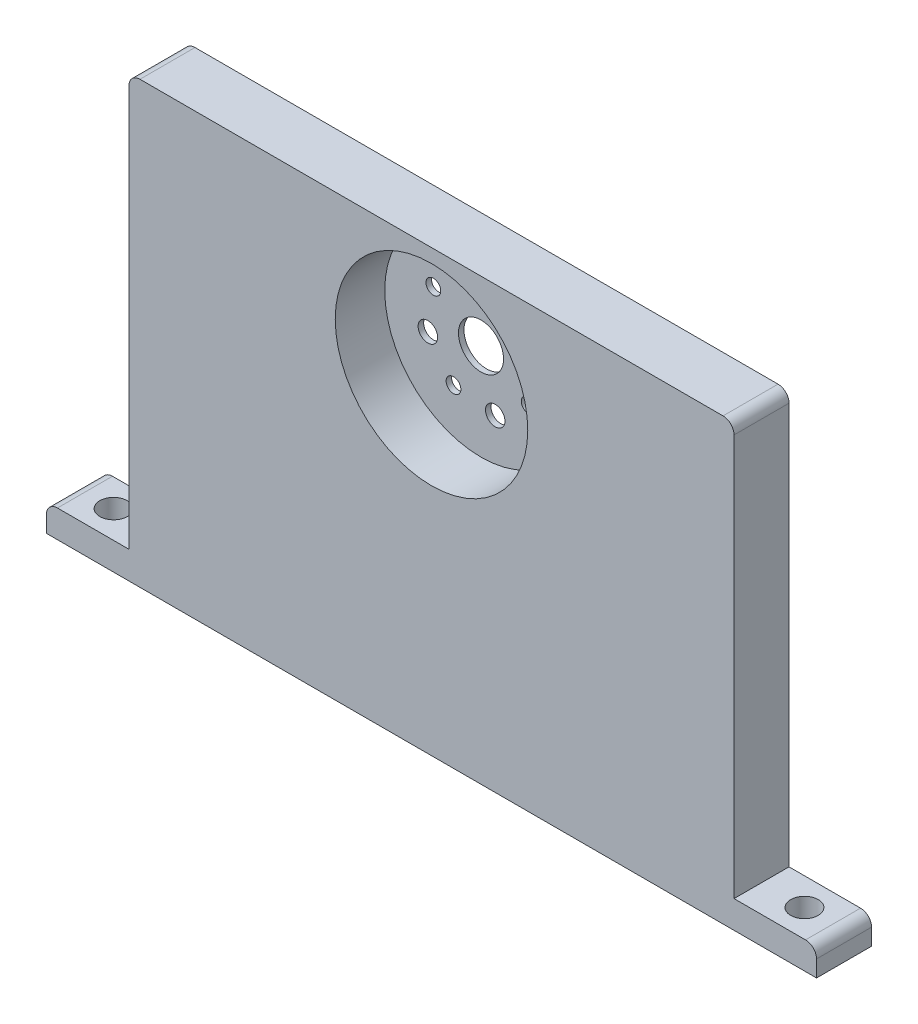
from build123d import *

# Parameters (mm, degrees)
SKETCH1_W           = 139.7
SKETCH1_H           = 12.7
BOSS_EXTRUDE1_DEPTH = 101.6
SKETCH2_W           = 12.7
SKETCH2_H           = 6.35
BOSS_EXTRUDE2_DEPTH = 19.05
CUT_EXTRUDE1_REACH  = 190.906
SKETCH3_R           = 5.207
SKETCH4_R           = 22.225
CUT_EXTRUDE2_DEPTH  = 11.43
CUT_EXTRUDE3_REACH  = 190.825
SKETCH5_R           = 1.7018
SKETCH5_R_2         = 2.2479
CUT_EXTRUDE4_REACH  = 187.568
SKETCH6_R           = 3.175
FILLET1_R           = 2.54


with BuildPart() as part:
    # Sketch1 → Boss-Extrude1 (new body)
    with BuildSketch(Plane(origin=(0, 0, 0), x_dir=(1, 0, 0), z_dir=(0, 1, 0))):
        with Locations((69.85, 6.35)):
            Rectangle(SKETCH1_W, SKETCH1_H)
    extrude(amount=BOSS_EXTRUDE1_DEPTH)

    # Sketch2 → Boss-Extrude2 (add)
    with BuildSketch(Plane.ZY):
        with Locations((-6.35, 3.175)):
            Rectangle(SKETCH2_W, SKETCH2_H)
    boss_extrude2 = extrude(amount=BOSS_EXTRUDE2_DEPTH)

    # Mirror1: Boss-Extrude2 across plane
    add(boss_extrude2.mirror(Plane.ZY.offset(-69.85)))

    # Sketch3 → Cut-Extrude1 (cut, up to next)
    with BuildSketch(Plane.XY, mode=Mode.PRIVATE) as cut_extrude1_sk1:
        with Locations((69.85, 76.2)):
            Circle(SKETCH3_R)
    cut_extrude1_tool1 = extrude(cut_extrude1_sk1.sketch, amount=-CUT_EXTRUDE1_REACH, mode=Mode.PRIVATE) & part.part
    add(cut_extrude1_tool1.solids().sort_by_distance((69.85, 76.2, 0))[0], mode=Mode.SUBTRACT)

    # Sketch4 → Cut-Extrude2 (cut)
    with BuildSketch(Plane.XY):
        with Locations((69.85, 76.2)):
            Circle(SKETCH4_R)
    extrude(amount=-CUT_EXTRUDE2_DEPTH, mode=Mode.SUBTRACT)

    # Sketch5 → Cut-Extrude3 (cut, up to next)
    with BuildSketch(Plane.XY.offset(-11.43), mode=Mode.PRIVATE) as cut_extrude3_sk1:
        with Locations((58.851477372, 82.55)):
            Circle(SKETCH5_R)
    cut_extrude3_tool1 = extrude(cut_extrude3_sk1.sketch, amount=-CUT_EXTRUDE3_REACH, mode=Mode.PRIVATE) & part.part
    # Sketch5 → Cut-Extrude3 (cut, up to next)
    with BuildSketch(Plane.XY.offset(-11.43), mode=Mode.PRIVATE) as cut_extrude3_sk2:
        with Locations((66.562998127, 88.467257994)):
            Circle(SKETCH5_R_2)
    cut_extrude3_tool2 = extrude(cut_extrude3_sk2.sketch, amount=-CUT_EXTRUDE3_REACH, mode=Mode.PRIVATE) & part.part
    # Sketch5 → Cut-Extrude3 (cut, up to next)
    with BuildSketch(Plane.XY.offset(-11.43), mode=Mode.PRIVATE) as cut_extrude3_sk3:
        with Locations((82.117257994, 79.487001873)):
            Circle(SKETCH5_R_2)
    cut_extrude3_tool3 = extrude(cut_extrude3_sk3.sketch, amount=-CUT_EXTRUDE3_REACH, mode=Mode.PRIVATE) & part.part
    # Sketch5 → Cut-Extrude3 (cut, up to next)
    with BuildSketch(Plane.XY.offset(-11.43), mode=Mode.PRIVATE) as cut_extrude3_sk4:
        with Locations((73.137001873, 63.932742006)):
            Circle(SKETCH5_R_2)
    cut_extrude3_tool4 = extrude(cut_extrude3_sk4.sketch, amount=-CUT_EXTRUDE3_REACH, mode=Mode.PRIVATE) & part.part
    # Sketch5 → Cut-Extrude3 (cut, up to next)
    with BuildSketch(Plane.XY.offset(-11.43), mode=Mode.PRIVATE) as cut_extrude3_sk5:
        with Locations((57.582742006, 72.912998127)):
            Circle(SKETCH5_R_2)
    cut_extrude3_tool5 = extrude(cut_extrude3_sk5.sketch, amount=-CUT_EXTRUDE3_REACH, mode=Mode.PRIVATE) & part.part
    # Sketch5 → Cut-Extrude3 (cut, up to next)
    with BuildSketch(Plane.XY.offset(-11.43), mode=Mode.PRIVATE) as cut_extrude3_sk6:
        with Locations((76.2, 87.198522628)):
            Circle(SKETCH5_R)
    cut_extrude3_tool6 = extrude(cut_extrude3_sk6.sketch, amount=-CUT_EXTRUDE3_REACH, mode=Mode.PRIVATE) & part.part
    # Sketch5 → Cut-Extrude3 (cut, up to next)
    with BuildSketch(Plane.XY.offset(-11.43), mode=Mode.PRIVATE) as cut_extrude3_sk7:
        with Locations((80.848522628, 69.85)):
            Circle(SKETCH5_R)
    cut_extrude3_tool7 = extrude(cut_extrude3_sk7.sketch, amount=-CUT_EXTRUDE3_REACH, mode=Mode.PRIVATE) & part.part
    # Sketch5 → Cut-Extrude3 (cut, up to next)
    with BuildSketch(Plane.XY.offset(-11.43), mode=Mode.PRIVATE) as cut_extrude3_sk8:
        with Locations((63.5, 65.201477372)):
            Circle(SKETCH5_R)
    cut_extrude3_tool8 = extrude(cut_extrude3_sk8.sketch, amount=-CUT_EXTRUDE3_REACH, mode=Mode.PRIVATE) & part.part
    add(cut_extrude3_tool1.solids().sort_by_distance((58.851477, 82.55, -11.43))[0], mode=Mode.SUBTRACT)
    add(cut_extrude3_tool2.solids().sort_by_distance((66.562998, 88.467258, -11.43))[0], mode=Mode.SUBTRACT)
    add(cut_extrude3_tool3.solids().sort_by_distance((82.117258, 79.487002, -11.43))[0], mode=Mode.SUBTRACT)
    add(cut_extrude3_tool4.solids().sort_by_distance((73.137002, 63.932742, -11.43))[0], mode=Mode.SUBTRACT)
    add(cut_extrude3_tool5.solids().sort_by_distance((57.582742, 72.912998, -11.43))[0], mode=Mode.SUBTRACT)
    add(cut_extrude3_tool6.solids().sort_by_distance((76.2, 87.198523, -11.43))[0], mode=Mode.SUBTRACT)
    add(cut_extrude3_tool7.solids().sort_by_distance((80.848523, 69.85, -11.43))[0], mode=Mode.SUBTRACT)
    add(cut_extrude3_tool8.solids().sort_by_distance((63.5, 65.201477, -11.43))[0], mode=Mode.SUBTRACT)

    # Sketch6 → Cut-Extrude4 (cut, up to next)
    with BuildSketch(Plane(origin=(0, 6.35, 0), x_dir=(1, 0, 0), z_dir=(0, 1, 0)), mode=Mode.PRIVATE) as cut_extrude4_sk1:
        with Locations(Location((-9.906, 6.35, 0), (0, 0, 270))):
            Circle(SKETCH6_R)
    cut_extrude4_tool1 = extrude(cut_extrude4_sk1.sketch, amount=-CUT_EXTRUDE4_REACH, mode=Mode.PRIVATE) & part.part
    cut_extrude4 = cut_extrude4_tool1.solids().sort_by_distance((-9.906, 6.35, -6.35))[0]
    add(cut_extrude4, mode=Mode.SUBTRACT)

    # Mirror2: Cut-Extrude4 across plane
    add(cut_extrude4.mirror(Plane.ZY.offset(-69.85)), mode=Mode.SUBTRACT)

    # Fillet1
    fillet1_edges = [part.edges().sort_by_distance(p)[0] for p in [
        (139.7, 101.6, -6.35),
        (-19.05, 6.35, -6.35),
        (158.75, 6.35, -6.35),
        (0, 101.6, -6.35),
    ]]
    fillet(fillet1_edges, radius=FILLET1_R)


solid = part.part
